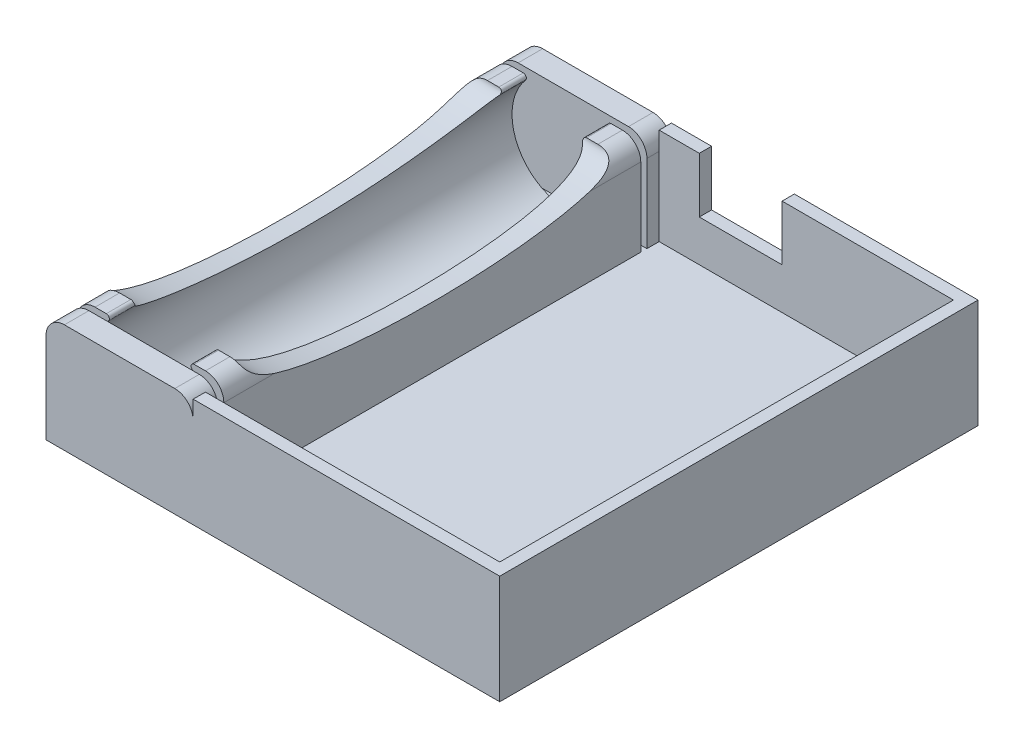
from build123d import *
from build123d.topology import SkipClean

# Parameters (mm, degrees)
SALIENTE_EXTRUIR2_DEPTH    = 70
SALIENTE_EXTRUIR4_START    = -4
SALIENTE_EXTRUIR4_DEPTH    = 4
SALIENTE_EXTRUIR5_START    = 70
SALIENTE_EXTRUIR5_DEPTH    = 4
CORTAR_EXTRUIR1_DEPTH      = 15
CORTAR_EXTRUIR1_DEPTH_BACK = 79.568441502
CROQUIS5_RX                = 30
CROQUIS5_RY                = 5.809368516
SALIENTE_EXTRUIR6_DEPTH    = 50
CROQUIS7_W                 = 2
CROQUIS7_H                 = 74
SALIENTE_EXTRUIR7_DEPTH    = 15.745948
CROQUIS9_R                 = 2.65
CROQUIS9_W                 = 11
CROQUIS9_H                 = 6
CORTAR_EXTRUIR2_DEPTH      = 10
CORTAR_EXTRUIR3_REACH      = 100.697
CROQUIS10_W                = 13.5
CROQUIS10_H                = 9


with BuildPart() as part:
    # Croquis1 → Saliente-Extruir2 (new body)
    with BuildSketch(Plane.XY):
        with BuildLine():
            Line((-9, 6.745948294), (-7.15808144, 6.745948294))
            ThreePointArc((-7.15808144, 6.745948294), (-6.702907265, 6.452869704), (-6.781340312, 5.917214173))
            ThreePointArc((-6.781340312, 5.917214173), (0, -9), (6.781340312, 5.917214173))
            ThreePointArc((6.781340312, 5.917214173), (6.702907265, 6.452869704), (7.15808144, 6.745948294))
            Line((7.15808144, 6.745948294), (9, 6.745948294))
            ThreePointArc((9, 6.745948294), (11.121320344, 5.867268638), (12, 3.745948294))
            Line((12, 3.745948294), (12, -11))
            Line((12, -11), (-12, -11))
            Line((-12, -11), (-12, 3.745948294))
            ThreePointArc((-12, 3.745948294), (-11.121320344, 5.867268638), (-9, 6.745948294))
        make_face()
    extrude(amount=SALIENTE_EXTRUIR2_DEPTH)

    # Croquis1<6> → Saliente-Extruir4 (add)
    with BuildSketch(Plane.XY.offset(SALIENTE_EXTRUIR4_START)):
        with BuildLine():
            Line((7.15808144, 6.745948294), (9, 6.745948294))
            ThreePointArc((9, 6.745948294), (11.121320344, 5.867268638), (12, 3.745948294))
            Line((12, 3.745948294), (12, -11))
            Line((12, -11), (-12, -11))
            Line((-12, -11), (-12, 3.745948294))
            ThreePointArc((-12, 3.745948294), (-11.121320344, 5.867268638), (-9, 6.745948294))
            Line((-9, 6.745948294), (-7.15808144, 6.745948294))
            ThreePointArc((-7.15808144, 6.745948294), (-6.702907265, 6.452869704), (-6.781340312, 5.917214173))
            ThreePointArc((-6.781340312, 5.917214173), (0, -9), (6.781340312, 5.917214173))
            ThreePointArc((6.781340312, 5.917214173), (6.702907265, 6.452869704), (7.15808144, 6.745948294))
        make_face()
        with BuildLine():
            Line((7.15808144, 6.745948294), (-7.15808144, 6.745948294))
            ThreePointArc((-7.15808144, 6.745948294), (-6.702907265, 6.452869704), (-6.781340312, 5.917214173))
            ThreePointArc((-6.781340312, 5.917214173), (0, -9), (6.781340312, 5.917214173))
            ThreePointArc((6.781340312, 5.917214173), (6.702907265, 6.452869704), (7.15808144, 6.745948294))
        make_face()
    extrude(amount=SALIENTE_EXTRUIR4_DEPTH)

    # Croquis1<9> → Saliente-Extruir5 (add)
    with BuildSketch(Plane.XY.offset(SALIENTE_EXTRUIR5_START)):
        with BuildLine():
            Line((7.15808144, 6.745948294), (9, 6.745948294))
            ThreePointArc((9, 6.745948294), (11.121320344, 5.867268638), (12, 3.745948294))
            Line((12, 3.745948294), (12, -11))
            Line((12, -11), (-12, -11))
            Line((-12, -11), (-12, 3.745948294))
            ThreePointArc((-12, 3.745948294), (-11.121320344, 5.867268638), (-9, 6.745948294))
            Line((-9, 6.745948294), (-7.15808144, 6.745948294))
            ThreePointArc((-7.15808144, 6.745948294), (-6.702907265, 6.452869704), (-6.781340312, 5.917214173))
            ThreePointArc((-6.781340312, 5.917214173), (0, -9), (6.781340312, 5.917214173))
            ThreePointArc((6.781340312, 5.917214173), (6.702907265, 6.452869704), (7.15808144, 6.745948294))
        make_face()
        with BuildLine():
            Line((7.15808144, 6.745948294), (-7.15808144, 6.745948294))
            ThreePointArc((-7.15808144, 6.745948294), (-6.702907265, 6.452869704), (-6.781340312, 5.917214173))
            ThreePointArc((-6.781340312, 5.917214173), (0, -9), (6.781340312, 5.917214173))
            ThreePointArc((6.781340312, 5.917214173), (6.702907265, 6.452869704), (7.15808144, 6.745948294))
        make_face()
    extrude(amount=SALIENTE_EXTRUIR5_DEPTH)

    # Croquis5 → Cortar-Extruir1 (cut, two sides: drawn at the far end of the back side and taken through both)
    with BuildSketch(Plane(origin=(12, 0, 0), x_dir=(0, 0, -1), z_dir=(1, 0, 0)).offset(-CORTAR_EXTRUIR1_DEPTH_BACK)):
        with Locations(Location((-35, 6.745948294), (0, 0, 0))):
            Ellipse(CROQUIS5_RX, CROQUIS5_RY)
        Polygon((0, 5.917214173), (0, -9), (-0.999510264, -9), (-0.999510264, 5.948506852), (-0.999510264, 6.745948294), (0, 6.745948294), align=None)
        Polygon((-70, 5.917214173), (-70, -9), (-69.000489736, -9), (-69.000489736, 5.948506852), (-69.000489736, 6.745948294), (-70, 6.745948294), align=None)
    extrude(amount=CORTAR_EXTRUIR1_DEPTH + CORTAR_EXTRUIR1_DEPTH_BACK, mode=Mode.SUBTRACT)

    # Croquis6 → Saliente-Extruir6 (add)
    with BuildSketch(Plane(origin=(12, 0, 0), x_dir=(0, 0, -1), z_dir=(1, 0, 0))):
        Polygon((-74, -11), (4, -11), (4, -9), (4, 6.745948294), (2, 6.745948294), (2, -9), (-72, -9), (-72, 6.745948294), (-74, 6.745948294), (-74, -9), align=None)
    extrude(amount=SALIENTE_EXTRUIR6_DEPTH)

    # Croquis7 → Saliente-Extruir7 (add)
    with SkipClean():  # the faces are left unmerged after this step: merging them gives an invalid solid
        with BuildSketch(Plane(origin=(0, -9, 0), x_dir=(1, 0, 0), z_dir=(0, 1, 0))):
            with Locations((61, -35)):
                Rectangle(CROQUIS7_W, CROQUIS7_H)
        extrude(amount=SALIENTE_EXTRUIR7_DEPTH)

    # Croquis9 → Cortar-Extruir2 (cut)
    with SkipClean():  # the faces are left unmerged after this step: merging them gives an invalid solid
        with BuildSketch(Plane(origin=(0, -9, 0), x_dir=(1, 0, 0), z_dir=(0, 1, 0))):
            with Locations(Location((51.5, -53.035506603, 0), (0, 0, 270))):
                Circle(CROQUIS9_R)
            with Locations((51.5, -35)):
                Rectangle(CROQUIS9_W, CROQUIS9_H)
        extrude(amount=-CORTAR_EXTRUIR2_DEPTH, mode=Mode.SUBTRACT)

    # Croquis10 → Cortar-Extruir3 (cut, up to next)
    with BuildSketch(Plane.XY.offset(-2), mode=Mode.PRIVATE) as cortar_extruir3_sk1:
        with Locations((25.297097726, 2.245948294)):
            Rectangle(CROQUIS10_W, CROQUIS10_H)
    cortar_extruir3_tool1 = extrude(cortar_extruir3_sk1.sketch, amount=-CORTAR_EXTRUIR3_REACH, mode=Mode.PRIVATE) & part.part
    add(cortar_extruir3_tool1.solids().sort_by_distance((25.297098, 2.245948, -2))[0], mode=Mode.SUBTRACT)


solid = part.part
